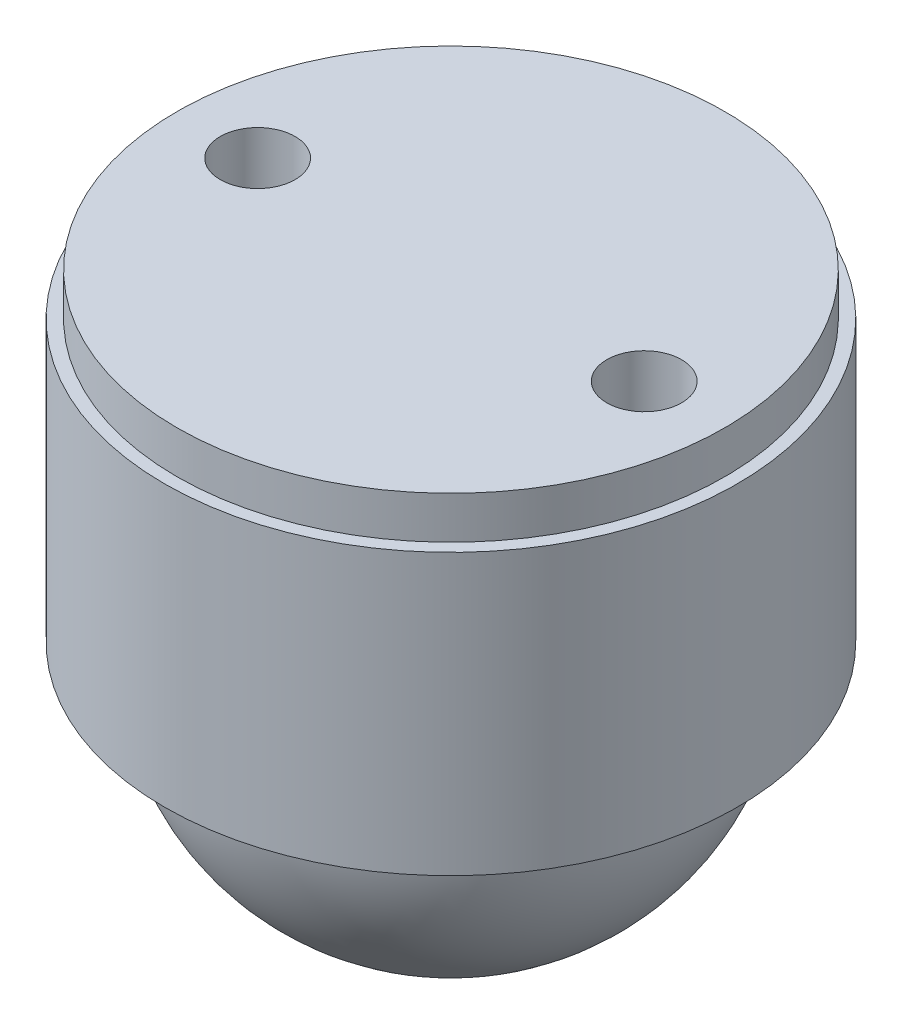
from build123d import *

# Parameters (mm, degrees)
SKETCH2_R           = 11.475
BOSS_EXTRUDE1_DEPTH = 11.225
SKETCH5_R           = 10.98
BOSS_EXTRUDE3_DEPTH = 1.7
SKETCH6_R           = 1.5
CUT_EXTRUDE4_DEPTH  = 5


with BuildPart() as part:
    # Sketch1 → Revolve1 (revolve)
    with BuildSketch(Plane(origin=(0, 0, 0), x_dir=(1, 0, 0), z_dir=(0, 1, 0))):
        with BuildLine():
            Line((0, 9.525), (0, -9.525))
            ThreePointArc((0, -9.525), (9.525, 0), (0, 9.525))
        make_face()
    revolve(axis=Axis((0, 0, -9.525), (0, 0, 1)))

    # Sketch2 → Boss-Extrude1 (add)
    with BuildSketch(Plane(origin=(0, 0, 0), x_dir=(1, 0, 0), z_dir=(0, 1, 0))):
        with Locations(Location((0, 0, 0), (0, 0, 270))):
            Circle(SKETCH2_R)
    extrude(amount=BOSS_EXTRUDE1_DEPTH)

    # Sketch5 → Boss-Extrude3 (add)
    with BuildSketch(Plane(origin=(0, 11.225, 0), x_dir=(1, 0, 0), z_dir=(0, 1, 0))):
        with Locations(Location((0, 0, 0), (0, 0, 270))):
            Circle(SKETCH5_R)
    extrude(amount=BOSS_EXTRUDE3_DEPTH)

    # Sketch6 → Cut-Extrude4 (cut)
    with BuildSketch(Plane(origin=(0, 12.925, 0), x_dir=(1, 0, 0), z_dir=(0, 1, 0))):
        with Locations(Location((7.747, 0, 0), (0, 0, 270))):
            Circle(SKETCH6_R)
        with Locations(Location((-7.747, 0, 0), (0, 0, 270))):
            Circle(SKETCH6_R)
    extrude(amount=-CUT_EXTRUDE4_DEPTH, mode=Mode.SUBTRACT)


solid = part.part
